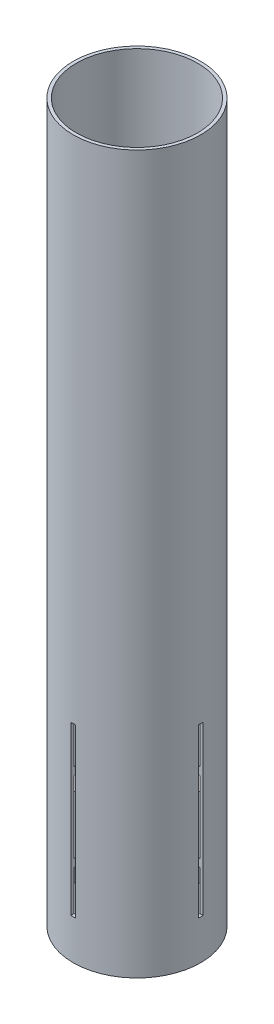
from build123d import *

# Parameters (mm, degrees)
SKETCH1_R           = 40
SKETCH1_R_2         = 38
BOSS_EXTRUDE1_DEPTH = 450
SKETCH3_R           = 38
SKETCH3_R_2         = 20
BOSS_EXTRUDE2_DEPTH = 5
LPATTERN1_COUNT     = 5
LPATTERN1_PITCH     = 50
BOSS_EXTRUDE3_START = -10
SKETCH6_R           = 38
BOSS_EXTRUDE3_DEPTH = 10
SKETCH2_W           = 3
SKETCH2_H           = 105
CUT_EXTRUDE6_DEPTH  = 10
CIRPATTERN6_COUNT   = 4


with BuildPart() as part:
    # Sketch1 → Boss-Extrude1 (new body)
    with BuildSketch(Plane(origin=(0, 0, 0), x_dir=(1, 0, 0), z_dir=(0, 1, 0))):
        with Locations(Location((0, 0, 0), (0, 0, 270))):
            Circle(SKETCH1_R)
        with Locations(Location((0, 0, 0), (0, 0, 270))):
            Circle(SKETCH1_R_2, mode=Mode.SUBTRACT)
    extrude(amount=BOSS_EXTRUDE1_DEPTH)

    # Sketch3 → Boss-Extrude2 (add)
    with BuildSketch(Plane.XZ):
        with Locations(Location((0, 0, 0), (0, 0, 270))):
            Circle(SKETCH3_R)
        with Locations(Location((0, 0, 0), (0, 0, 270))):
            Circle(SKETCH3_R_2, mode=Mode.SUBTRACT)
    boss_extrude2 = extrude(amount=-BOSS_EXTRUDE2_DEPTH)

    # LPattern1: Boss-Extrude2 ×5
    with Locations(*[(0, i * LPATTERN1_PITCH, 0) for i in range(1, LPATTERN1_COUNT)]):
        add(boss_extrude2)

    # Sketch6 → Boss-Extrude3 (add)
    with BuildSketch(Plane(origin=(0, 255, 0), x_dir=(1, 0, 0), z_dir=(0, 1, 0)).offset(BOSS_EXTRUDE3_START)):
        with Locations(Location((0, 0, 0), (0, 0, 90))):
            Circle(SKETCH6_R)
    extrude(amount=BOSS_EXTRUDE3_DEPTH)

    # Sketch2 → Cut-Extrude6 (cut)
    with BuildSketch(Plane.ZY.offset(40)):
        with Locations((0, 77.5)):
            Rectangle(SKETCH2_W, SKETCH2_H)
    cut_extrude6 = extrude(amount=-CUT_EXTRUDE6_DEPTH, mode=Mode.SUBTRACT)

    # CirPattern6: Cut-Extrude6 ×4 about axis
    cirpattern6_axis = Axis((0, 0, 0), (0, 1, 0))
    for i in range(1, CIRPATTERN6_COUNT):
        add(cut_extrude6.rotate(cirpattern6_axis, i * 360 / CIRPATTERN6_COUNT), mode=Mode.SUBTRACT)


solid = part.part
